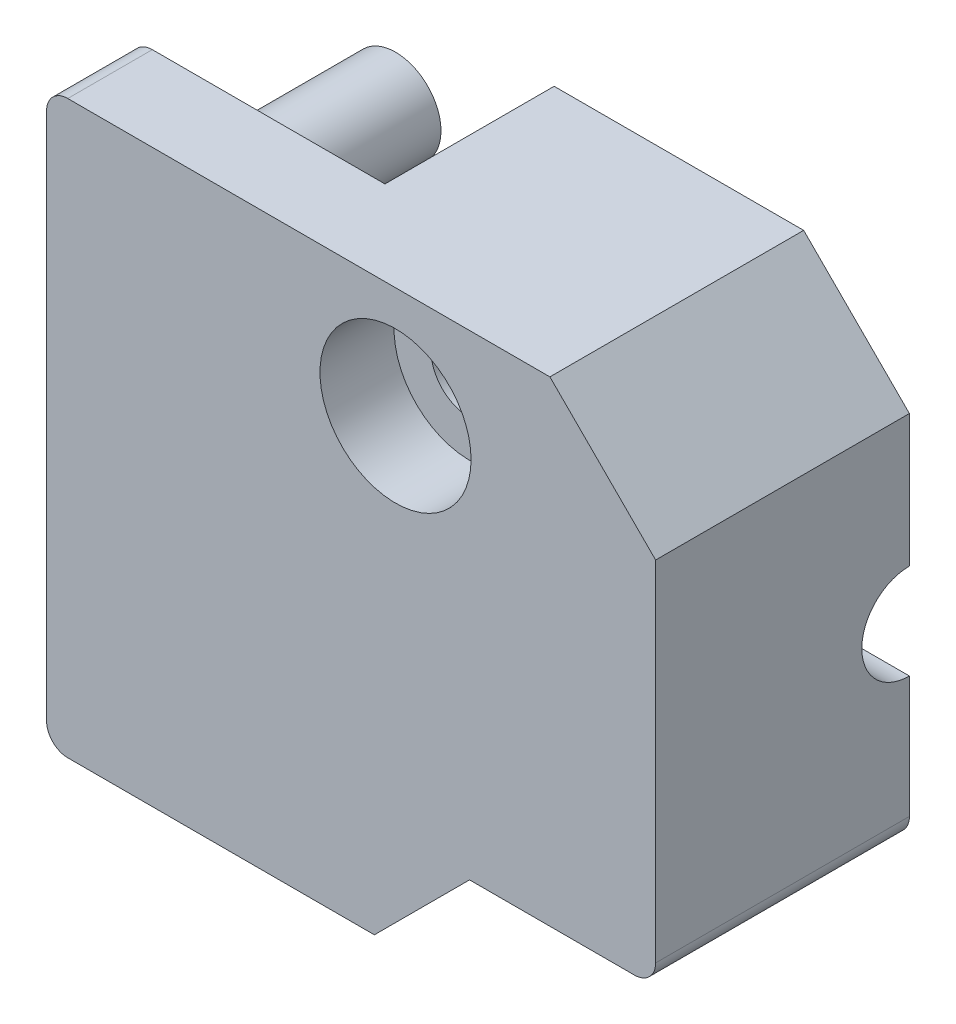
from build123d import *

# Parameters (mm, degrees)
BOSS_EXTRUDE1_DEPTH                            = 4
SKETCH3_R                                      = 2.15
BOSS_EXTRUDE2_DEPTH                            = 8
BOSS_EXTRUDE3_DEPTH                            = 8
CUT_EXTRUDE2_REACH                             = 34.144
SKETCH4_R                                      = 2.25
SKETCH4_4_W                                    = 12.7
SKETCH4_4_H                                    = 12.7
SKETCH4_4_R                                    = 2.25
CUT_EXTRUDE3_DEPTH                             = 8.5
BOSS_EXTRUDE4_DEPTH                            = 5.8
BOSS_EXTRUDE7_DEPTH                            = 3
CBORE_FOR_6_SOCKET_HEAD_CAP_SCREW1_D           = 3.6576
CBORE_FOR_6_SOCKET_HEAD_CAP_SCREW1_CBORE_D     = 7.14502
CBORE_FOR_6_SOCKET_HEAD_CAP_SCREW1_CBORE_DEPTH = 3.5052
SKETCH12_R                                     = 1.75
BOSS_EXTRUDE8_DEPTH                            = 2
CHAMFER1_SIZE                                  = 5
FILLET1_R                                      = 1


with BuildPart() as part:
    # Sketch2 → Boss-Extrude1 (new body)
    with BuildSketch(Plane.XY):
        with BuildLine():
            Line((15.5, 0), (20, 4.5))
            Line((20, 4.5), (20, 27))
            Line((20, 27), (1, 27))
            ThreePointArc((1, 27), (0.292893219, 26.707106781), (0, 26))
            Line((0, 26), (0, 1))
            ThreePointArc((0, 1), (0.292893219, 0.292893219), (1, 0))
            Line((1, 0), (15.5, 0))
        make_face()
    extrude(amount=BOSS_EXTRUDE1_DEPTH)

    # Sketch3 → Boss-Extrude2 (add)
    with BuildSketch(Plane.XY):
        with Locations((4.5, 22.5)):
            Circle(SKETCH3_R)
        with Locations((4.5, 4.5)):
            Circle(SKETCH3_R)
    extrude(amount=-BOSS_EXTRUDE2_DEPTH)

    # Sketch3<3> → Boss-Extrude3 (add)
    with BuildSketch(Plane.XY):
        with BuildLine():
            Line((4.5, 15), (4.5, 12))
            ThreePointArc((4.5, 12), (8.782801805, 10.656915518), (11.531693039, 7.108695652))
            ThreePointArc((11.531693039, 7.108695652), (12.997768364, 5.216311724), (15.281929326, 4.5))
            Line((15.281929326, 4.5), (20, 4.5))
            Line((20, 4.5), (20, 27))
            Line((20, 27), (12, 27))
            Line((12, 27), (12, 22.5))
            ThreePointArc((12, 22.5), (9.803300859, 17.196699141), (4.5, 15))
        make_face()
    extrude(amount=-BOSS_EXTRUDE3_DEPTH)

    # Cut-Extrude2: up to this face of the body (flat: up to its plane)
    cut_extrude2_end = Plane(part.part.faces().sort_by_distance((20, 15.75, -2))[0])
    # Sketch4 → Cut-Extrude2 (cut, up to the picked face)
    with BuildSketch(Plane(origin=(4.5, 0, 0), x_dir=(0, 0, -1), z_dir=(1, 0, 0)), mode=Mode.PRIVATE) as cut_extrude2_sk1:
        with Locations((8, 13.5)):
            Circle(SKETCH4_R)
    cut_extrude2_tool1 = split(extrude(cut_extrude2_sk1.sketch, amount=CUT_EXTRUDE2_REACH, mode=Mode.PRIVATE), bisect_by=cut_extrude2_end, keep=Keep.BOTH, mode=Mode.PRIVATE)
    add(cut_extrude2_tool1.solids().sort_by(Axis((4.5, 13.5, -8), (1, 0, 0)))[0], mode=Mode.SUBTRACT)

    # Sketch4<4> → Cut-Extrude3 (cut)
    with BuildSketch(Plane(origin=(4.5, 0, 0), x_dir=(0, 0, -1), z_dir=(1, 0, 0))):
        with Locations((8, 13.5)):
            Rectangle(SKETCH4_4_W, SKETCH4_4_H)
        with Locations((8, 13.5)):
            Circle(SKETCH4_4_R, mode=Mode.SUBTRACT)
    extrude(amount=CUT_EXTRUDE3_DEPTH, mode=Mode.SUBTRACT)

    # Sketch5 → Boss-Extrude4 (add)
    with BuildSketch(Plane(origin=(20, 0, 0), x_dir=(0, 0, -1), z_dir=(1, 0, 0))):
        with BuildLine():
            Line((1.45, 4.5), (1.45, 9.745003329))
            ThreePointArc((1.45, 9.745003329), (1.467285217, 17.28498845), (8, 21.05))
            Line((8, 21.05), (8, 27))
            Line((8, 27), (-4, 27))
            Line((-4, 27), (-4, 4.5))
            Line((-4, 4.5), (0, 4.5))
            Line((0, 4.5), (1.45, 4.5))
        make_face()
    extrude(amount=BOSS_EXTRUDE4_DEPTH)

    # Sketch8 → Boss-Extrude7 (add)
    with BuildSketch(Plane(origin=(25.8, 0, 0), x_dir=(0, 0, -1), z_dir=(1, 0, 0))):
        with BuildLine():
            Line((1.45, 4.5), (1.45, 9.745003329))
            ThreePointArc((1.45, 9.745003329), (1.467285217, 17.28498845), (8, 21.05))
            Line((8, 21.05), (8, 27))
            Line((8, 27), (-4, 27))
            Line((-4, 27), (-4, 4.5))
            Line((-4, 4.5), (1.45, 4.5))
        make_face()
        with BuildLine():
            Line((8, 15.75), (8, 21.05))
            ThreePointArc((8, 21.05), (1.467285217, 17.28498845), (1.45, 9.745003329))
            Line((1.45, 9.745003329), (1.45, 4.5))
            Line((1.45, 4.5), (8, 4.5))
            Line((8, 4.5), (8, 11.25))
            ThreePointArc((8, 11.25), (5.75, 13.5), (8, 15.75))
        make_face()
    extrude(amount=BOSS_EXTRUDE7_DEPTH)

    # CBORE for #6 Socket Head Cap Screw1 (through all)
    with Locations(Plane.XY.offset(4)):
        with Locations((16.5, 21.75)):
            CounterBoreHole(CBORE_FOR_6_SOCKET_HEAD_CAP_SCREW1_D / 2, CBORE_FOR_6_SOCKET_HEAD_CAP_SCREW1_CBORE_D / 2, CBORE_FOR_6_SOCKET_HEAD_CAP_SCREW1_CBORE_DEPTH)

    # Sketch12 → Boss-Extrude8 (add)
    with BuildSketch(Plane(origin=(0, 0, -8), x_dir=(-1, 0, 0), z_dir=(0, 0, -1))):
        with Locations(Location((-16.5, 7.875, 0), (0, 0, 180))):
            Circle(SKETCH12_R)
    extrude(amount=BOSS_EXTRUDE8_DEPTH)

    # Chamfer1
    chamfer1_edges = [part.edges().sort_by_distance(p)[0] for p in [
        (28.8, 27, -2),
    ]]
    chamfer(chamfer1_edges, length=CHAMFER1_SIZE)

    # Fillet1
    fillet1_edges = [part.edges().sort_by_distance(p)[0] for p in [
        (28.8, 4.5, -2),
    ]]
    fillet(fillet1_edges, radius=FILLET1_R)


solid = part.part
